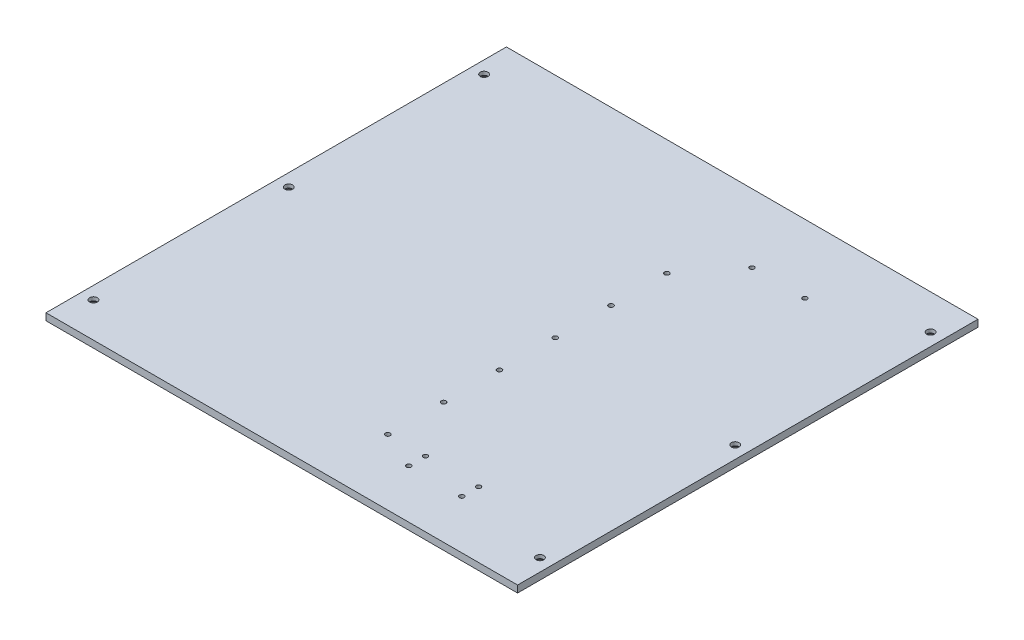
from build123d import *

# Parameters (mm, degrees)
SKETCH_1_W                  = 340
SKETCH_1_H                  = 330
EXTRUDE_1_DEPTH             = 5
M4X0_7_2_D                  = 3.3
M4X0_7_2_DEPTH              = 11.5
M4X0_7_2_TIP                = 0.991420021
SKETCH_4_W                  = 1
SKETCH_4_H                  = 330
CUT_EXTRUDE_1_DEPTH         = 10
HOLE_WIZARD_M3_1_D          = 3.4
HOLE_WIZARD_M3_1_DEPTH      = 20
HOLE_WIZARD_M3_1_TIP        = 1.021463052
HOLE_WIZARD_M5_1_AT_2_COUNT = 2
HOLE_WIZARD_M5_1_AT_2_PITCH = 140
HOLE_WIZARD_M5_1_AT_3_COUNT = 2
HOLE_WIZARD_M5_1_AT_3_PITCH = 280
HOLE_WIZARD_M5_1_AT_4_COUNT = 2
HOLE_WIZARD_M5_1_AT_4_PITCH = 425.205832509
HOLE_WIZARD_M5_1_AT_5_COUNT = 2
HOLE_WIZARD_M5_1_AT_5_PITCH = 349.284983931
HOLE_WIZARD_M5_1_AT_6_COUNT = 2
HOLE_WIZARD_M5_1_AT_6_PITCH = 320


with BuildPart() as part:
    # 스케치1 → 보스-돌출1 (new body)
    with BuildSketch(Plane(origin=(0, 0, 0), x_dir=(1, 0, 0), z_dir=(0, 1, 0))):
        with Locations((170, 165)):
            Rectangle(SKETCH_1_W, SKETCH_1_H)
    extrude(amount=EXTRUDE_1_DEPTH)

    # M4x0.7 나사 구멍2
    with Locations(Plane(origin=(0, 5, 0), x_dir=(1, 0, 0), z_dir=(0, 1, 0))):
        with Locations((226, 281), (264, 281), (264, 35), (226, 35), (264, 47), (226, 47)):
            Hole(M4X0_7_2_D / 2, depth=M4X0_7_2_DEPTH)
            with Locations((0, 0, -(M4X0_7_2_DEPTH + M4X0_7_2_TIP / 2))):  # 118° drill point
                Cone(0, M4X0_7_2_D / 2, M4X0_7_2_TIP, mode=Mode.SUBTRACT)

    # 스케치4 → 컷-돌출1 (cut)
    with BuildSketch(Plane(origin=(0, 5, 0), x_dir=(1, 0, 0), z_dir=(0, 1, 0))):
        with Locations((339.5, 165)):
            Rectangle(SKETCH_4_W, SKETCH_4_H)
        with Locations((0.5, 165)):
            Rectangle(SKETCH_4_W, SKETCH_4_H)
    extrude(amount=-CUT_EXTRUDE_1_DEPTH, mode=Mode.SUBTRACT)

    # M3 여유 구멍1
    with Locations(Plane(origin=(0, 0, 0), x_dir=(-1, 0, 0), z_dir=(0, -1, 0))):
        with Locations((-199, 47), (-199, 87), (-199, 127), (-199, 167), (-199, 207), (-199, 247)):
            Hole(HOLE_WIZARD_M3_1_D / 2, depth=HOLE_WIZARD_M3_1_DEPTH)
            with Locations((0, 0, -(HOLE_WIZARD_M3_1_DEPTH + HOLE_WIZARD_M3_1_TIP / 2))):  # 118° drill point
                Cone(0, HOLE_WIZARD_M3_1_D / 2, HOLE_WIZARD_M3_1_TIP, mode=Mode.SUBTRACT)

    # 스케치7 → M5 납작 머리 작은 나사용 카운터싱크1 (revolve, cut)
    with BuildSketch(Plane(origin=(10, 0, -25), x_dir=(0, 0, -1), z_dir=(1, 0, 0))):
        Polygon((0, 0), (0, 5), (2.75, 5), (2.75, 2.45), (5.2, 0), align=None)
    hole_wizard_m5_1 = revolve(axis=Axis((10, -6.35, -25), (0, 1, 0)), mode=Mode.SUBTRACT)

    # M5 납작 머리 작은 나사용 카운터싱크1 at 2: M5 납작 머리 작은 나사용 카운터싱크1 ×2
    with Locations(*[(0, 0, -i * HOLE_WIZARD_M5_1_AT_2_PITCH) for i in range(1, HOLE_WIZARD_M5_1_AT_2_COUNT)]):
        add(hole_wizard_m5_1, mode=Mode.SUBTRACT)

    # M5 납작 머리 작은 나사용 카운터싱크1 at 3: M5 납작 머리 작은 나사용 카운터싱크1 ×2
    with Locations(*[(0, 0, -i * HOLE_WIZARD_M5_1_AT_3_PITCH) for i in range(1, HOLE_WIZARD_M5_1_AT_3_COUNT)]):
        add(hole_wizard_m5_1, mode=Mode.SUBTRACT)

    # M5 납작 머리 작은 나사용 카운터싱크1 at 4: M5 납작 머리 작은 나사용 카운터싱크1 ×2
    with Locations(*[Vector(0.7525766947068778, 0, -0.658504607868518) * (i * HOLE_WIZARD_M5_1_AT_4_PITCH) for i in range(1, HOLE_WIZARD_M5_1_AT_4_COUNT)]):
        add(hole_wizard_m5_1, mode=Mode.SUBTRACT)

    # M5 납작 머리 작은 나사용 카운터싱크1 at 5: M5 납작 머리 작은 나사용 카운터싱크1 ×2
    with Locations(*[Vector(0.9161573349021892, 0, -0.4008188340197077) * (i * HOLE_WIZARD_M5_1_AT_5_PITCH) for i in range(1, HOLE_WIZARD_M5_1_AT_5_COUNT)]):
        add(hole_wizard_m5_1, mode=Mode.SUBTRACT)

    # M5 납작 머리 작은 나사용 카운터싱크1 at 6: M5 납작 머리 작은 나사용 카운터싱크1 ×2
    with Locations(*[(i * HOLE_WIZARD_M5_1_AT_6_PITCH, 0, 0) for i in range(1, HOLE_WIZARD_M5_1_AT_6_COUNT)]):
        add(hole_wizard_m5_1, mode=Mode.SUBTRACT)


solid = part.part
